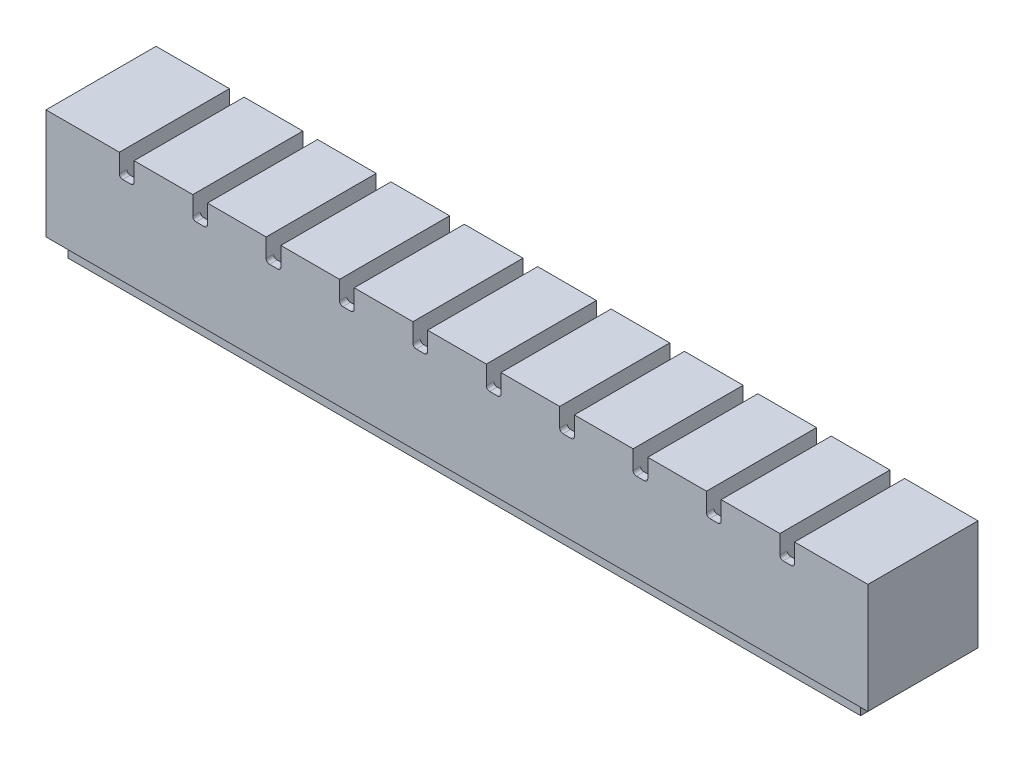
from build123d import *

# Parameters (mm, degrees)
SKETCH1_W                       = 8
SKETCH1_H                       = 15
FIRST_CHAMBER_BLOCK_DEPTH       = 15
SKETCH2_W                       = 6
SKETCH2_H                       = 11
FIRST_CHAMBER_CAVITY_DEPTH      = 13
SKETCH3_W                       = 15
SKETCH3_H                       = 3
CHAMBER_SPACER_DEPTH            = 2
PATTERN_CHAMBERS_COUNT          = 11
PATTERN_CHAMBERS_PITCH          = 10
SKETCH4_W                       = 15
SKETCH4_H                       = 12
THICKEN_END_1_DEPTH             = 2
SKETCH5_W                       = 15
SKETCH5_H                       = 15
THICKEN_END_2_DEPTH             = 2
SKETCH6_W                       = 94
SKETCH6_H                       = 2
CENTRAL_AIR_CHANNEL_DEPTH       = 2
SKETCH7_W                       = 108
SKETCH7_H                       = 13
SKETCH7_W_2                     = 106
SKETCH7_H_2                     = 11
BONDING_RIDGE_DEPTH             = 2
SKETCH9_W                       = 2
SKETCH9_H                       = 2.5
BONDING_BUMPS_DEPTH             = 2
PATTERN_BONDING_BUMPS_COUNT     = 10
PATTERN_BONDING_BUMPS_PITCH     = 10
AUFSATZ_LINEAR_AUSTRAGEN3_REACH = 106.183
SCHNITT_LINEAR_AUSTRAGEN2_DEPTH = 113.026782512
LINEARES_MUSTER8_COUNT          = 10
LINEARES_MUSTER8_PITCH          = 10


with BuildPart() as part:
    # Sketch1 → first chamber block (new body)
    with BuildSketch(Plane.XY):
        with Locations((4, 7.5)):
            Rectangle(SKETCH1_W, SKETCH1_H)
    extrude(amount=FIRST_CHAMBER_BLOCK_DEPTH)

    # Sketch2 → first chamber cavity (cut)
    with BuildSketch(Plane.XZ):
        with Locations((4, 7.5)):
            Rectangle(SKETCH2_W, SKETCH2_H)
    extrude(amount=-FIRST_CHAMBER_CAVITY_DEPTH, mode=Mode.SUBTRACT)

    # Sketch3 → chamber spacer (add)
    with BuildSketch(Plane(origin=(8, 0, 0), x_dir=(0, 0, -1), z_dir=(1, 0, 0))):
        with Locations((-7.5, 1.5)):
            Rectangle(SKETCH3_W, SKETCH3_H)
    extrude(amount=CHAMBER_SPACER_DEPTH)


with BuildPart() as pattern_chambers_1:
    # pattern chambers: pattern copy
    add(part.part.moved(Location(Vector(1, 0, 0) * (1 * PATTERN_CHAMBERS_PITCH))))


with BuildPart() as pattern_chambers_2:
    # pattern chambers: pattern copy
    add(part.part.moved(Location(Vector(1, 0, 0) * (2 * PATTERN_CHAMBERS_PITCH))))


with BuildPart() as pattern_chambers_3:
    # pattern chambers: pattern copy
    add(part.part.moved(Location(Vector(1, 0, 0) * (3 * PATTERN_CHAMBERS_PITCH))))


with BuildPart() as pattern_chambers_4:
    # pattern chambers: pattern copy
    add(part.part.moved(Location(Vector(1, 0, 0) * (4 * PATTERN_CHAMBERS_PITCH))))


with BuildPart() as pattern_chambers_5:
    # pattern chambers: pattern copy
    add(part.part.moved(Location(Vector(1, 0, 0) * (5 * PATTERN_CHAMBERS_PITCH))))


with BuildPart() as pattern_chambers_6:
    # pattern chambers: pattern copy
    add(part.part.moved(Location(Vector(1, 0, 0) * (6 * PATTERN_CHAMBERS_PITCH))))


with BuildPart() as pattern_chambers_7:
    # pattern chambers: pattern copy
    add(part.part.moved(Location(Vector(1, 0, 0) * (7 * PATTERN_CHAMBERS_PITCH))))


with BuildPart() as pattern_chambers_8:
    # pattern chambers: pattern copy
    add(part.part.moved(Location(Vector(1, 0, 0) * (8 * PATTERN_CHAMBERS_PITCH))))


with BuildPart() as pattern_chambers_9:
    # pattern chambers: pattern copy
    add(part.part.moved(Location(Vector(1, 0, 0) * (9 * PATTERN_CHAMBERS_PITCH))))


with BuildPart() as pattern_chambers_10:
    # pattern chambers: pattern copy
    add(part.part.moved(Location(Vector(1, 0, 0) * (10 * PATTERN_CHAMBERS_PITCH))))

    # combine into 1 solid body: union pattern chambers_9, pattern chambers_8, pattern chambers_7, pattern chambers_6, pattern chambers_5, pattern chambers_4, pattern chambers_3, pattern chambers_2, pattern chambers_1, part
    add(pattern_chambers_9.part)
    add(pattern_chambers_8.part)
    add(pattern_chambers_7.part)
    add(pattern_chambers_6.part)
    add(pattern_chambers_5.part)
    add(pattern_chambers_4.part)
    add(pattern_chambers_3.part)
    add(pattern_chambers_2.part)
    add(pattern_chambers_1.part)
    add(part.part)

    # Sketch4 → thicken end 1 (add)
    with BuildSketch(Plane(origin=(108, 0, 0), x_dir=(0, 0, -1), z_dir=(1, 0, 0))):
        with Locations((-7.5, 9)):
            Rectangle(SKETCH4_W, SKETCH4_H)
    extrude(amount=THICKEN_END_1_DEPTH)

    # Sketch5 → thicken end 2 (add)
    with BuildSketch(Plane.ZY):
        with Locations((7.5, 7.5)):
            Rectangle(SKETCH5_W, SKETCH5_H)
    extrude(amount=THICKEN_END_2_DEPTH)

    # Sketch6 → central air channel (cut)
    with BuildSketch(Plane.XZ):
        with Locations((54, 7.5)):
            Rectangle(SKETCH6_W, SKETCH6_H)
    extrude(amount=-CENTRAL_AIR_CHANNEL_DEPTH, mode=Mode.SUBTRACT)

    # Sketch7 → bonding ridge (add)
    with BuildSketch(Plane.XZ):
        with Locations((54, 7.5)):
            Rectangle(SKETCH7_W, SKETCH7_H)
        with Locations((54, 7.5)):
            Rectangle(SKETCH7_W_2, SKETCH7_H_2, mode=Mode.SUBTRACT)
    extrude(amount=BONDING_RIDGE_DEPTH)

    # Sketch9 → bonding bumps (add)
    with BuildSketch(Plane.XZ):
        with Locations((9, 10.75)):
            Rectangle(SKETCH9_W, SKETCH9_H)
        with Locations((9, 4.25)):
            Rectangle(SKETCH9_W, SKETCH9_H)
    bonding_bumps = extrude(amount=BONDING_BUMPS_DEPTH)

    # pattern bonding bumps: bonding bumps ×10
    with Locations(*[(i * PATTERN_BONDING_BUMPS_PITCH, 0, 0) for i in range(1, PATTERN_BONDING_BUMPS_COUNT)]):
        add(bonding_bumps)

    # Skizze3 → Aufsatz-Linear austragen3 (add, up to next)
    with BuildSketch(Plane(origin=(8, 0, 0), x_dir=(0, 0, -1), z_dir=(1, 0, 0)), mode=Mode.PRIVATE) as aufsatz_linear_austragen3_sk1:
        Polygon((-15, 3), (-13.5, 3), (-14, 12.5), (-15, 12.5), align=None)
    aufsatz_linear_austragen3_tool1 = extrude(aufsatz_linear_austragen3_sk1.sketch, amount=AUFSATZ_LINEAR_AUSTRAGEN3_REACH, mode=Mode.PRIVATE) - pattern_chambers_10.part
    # Skizze3 → Aufsatz-Linear austragen3 (add, up to next)
    with BuildSketch(Plane(origin=(8, 0, 0), x_dir=(0, 0, -1), z_dir=(1, 0, 0)), mode=Mode.PRIVATE) as aufsatz_linear_austragen3_sk2:
        Polygon((0, 12.5), (0, 3), (-1.5, 3), (-1, 12.5), align=None)
    aufsatz_linear_austragen3_tool2 = extrude(aufsatz_linear_austragen3_sk2.sketch, amount=AUFSATZ_LINEAR_AUSTRAGEN3_REACH, mode=Mode.PRIVATE) - pattern_chambers_10.part
    aufsatz_linear_austragen3_1 = aufsatz_linear_austragen3_tool1.solids().sort_by_distance((8, 7.433333, 14.366667))[0]
    add(aufsatz_linear_austragen3_1)
    aufsatz_linear_austragen3_2 = aufsatz_linear_austragen3_tool2.solids().sort_by_distance((8, 7.433333, 0.633333))[0]
    add(aufsatz_linear_austragen3_2)
    aufsatz_linear_austragen3 = aufsatz_linear_austragen3_1 + aufsatz_linear_austragen3_2  # Aufsatz-Linear austragen3 as one shape, for the pattern or mirror that repeats it

    # Skizze5 → Schnitt-Linear austragen2 (cut, through all)
    with BuildSketch(Plane(origin=(0, 0, 0), x_dir=(-1, 0, 0), z_dir=(0, 0, -1))):
        with BuildLine():
            Line((-10, 12.5), (-8, 12.5))
            Line((-8, 12.5), (-8, 12.45))
            ThreePointArc((-8, 12.45), (-8.131801948, 12.131801948), (-8.45, 12))
            Line((-8.45, 12), (-9.55, 12))
            ThreePointArc((-9.55, 12), (-9.868198052, 12.131801948), (-10, 12.45))
            Line((-10, 12.45), (-10, 12.5))
        make_face()
    schnitt_linear_austragen2 = extrude(amount=-SCHNITT_LINEAR_AUSTRAGEN2_DEPTH, mode=Mode.SUBTRACT)

    # Lineares Muster8: Aufsatz-Linear austragen3, Schnitt-Linear austragen2 ×10
    with Locations(*[(i * LINEARES_MUSTER8_PITCH, 0, 0) for i in range(1, LINEARES_MUSTER8_COUNT)]):
        add(aufsatz_linear_austragen3)
        add(schnitt_linear_austragen2, mode=Mode.SUBTRACT)


solid = pattern_chambers_10.part
